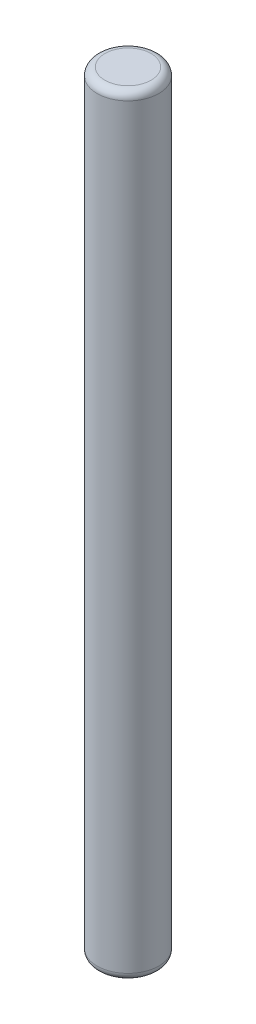
from build123d import *

# Parameters (mm, degrees)
SKETCH_1_R      = 2
EXTRUDE_1_DEPTH = 50
FILLET_1_R      = 0.5


with BuildPart() as part:
    # 草图1 → 凸台-拉伸1 (new body)
    with BuildSketch(Plane(origin=(0, 0, 0), x_dir=(1, 0, 0), z_dir=(0, 1, 0))):
        with Locations(Location((0, 0, 0), (0, 0, 270))):
            Circle(SKETCH_1_R)
    extrude(amount=EXTRUDE_1_DEPTH)

    # 圆角1
    fillet_1_edges = [part.edges().sort_by_distance(p)[0] for p in [
        (0, 0, -2),
        (0, 50, -2),
    ]]
    fillet(fillet_1_edges, radius=FILLET_1_R)


solid = part.part
